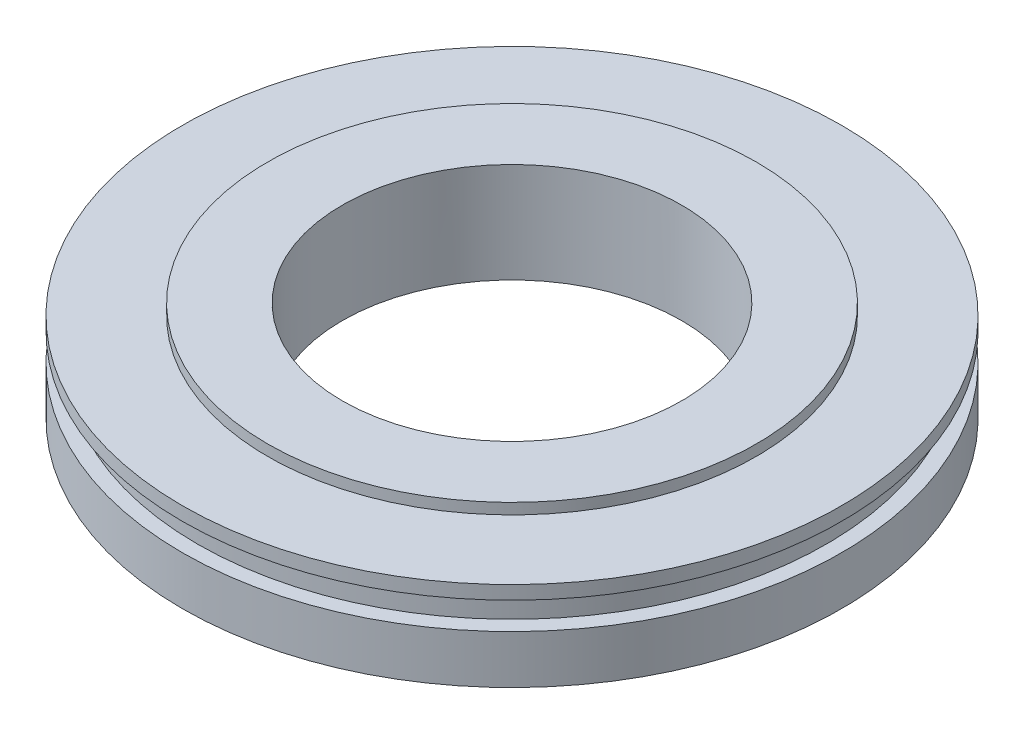
from build123d import *

# Parameters (mm, degrees)
BANDAID_START                  = 0.053848
SKETCH3_R                      = 30.84068
SKETCH3_R_2                    = 15.875
BANDAID_SOLUTION_THICKER_DEPTH = 0.053848
SKETCH4_R                      = 22.86
SKETCH4_R_2                    = 15.875
LIP_FOR_BEARING_DEPTH          = 1.016
SKETCH5_R                      = 30.84068
SKETCH5_R_2                    = 15.875
BOSS_EXTRUDE1_DEPTH            = 0.57912


with BuildPart() as part:
    # Sketch1 → Revolve1 (revolve)
    with BuildSketch(Plane(origin=(0, 0, 0), x_dir=(0, 0, -1), z_dir=(1, 0, 0))):
        Polygon((-15.875, 2.694084), (-15.875, -5.020818), (-30.84068, -5.020818), (-30.84068, -1.062068), (-29.43479, -1.062068), (-29.43479, 1.477932), (-30.84068, 1.477932), (-30.84068, 2.694084), align=None)
    revolve(axis=Axis((0, 0, 0), (0, -1, 0)))

    # Sketch3 → BandAid Solution thicker (add)
    with BuildSketch(Plane(origin=(0, 2.694084, 0), x_dir=(1, 0, 0), z_dir=(0, 1, 0)).offset(BANDAID_START)):
        with Locations(Location((0, 0, 0), (0, 0, 270))):
            Circle(SKETCH3_R)
        with Locations(Location((0, 0, 0), (0, 0, 270))):
            Circle(SKETCH3_R_2, mode=Mode.SUBTRACT)
    extrude(amount=-BANDAID_SOLUTION_THICKER_DEPTH)

    # Sketch4 → Lip for Bearing (add)
    with BuildSketch(Plane(origin=(0, 2.747932, 0), x_dir=(1, 0, 0), z_dir=(0, 1, 0))):
        with Locations(Location((0, 0, 0), (0, 0, 90))):
            Circle(SKETCH4_R)
        with Locations(Location((0, 0, 0), (0, 0, 270))):
            Circle(SKETCH4_R_2, mode=Mode.SUBTRACT)
    extrude(amount=LIP_FOR_BEARING_DEPTH)

    # Sketch5 → Boss-Extrude1 (add)
    with BuildSketch(Plane.XZ.offset(5.020818)):
        with Locations(Location((0, 0, 0), (0, 0, 90))):
            Circle(SKETCH5_R)
        with Locations(Location((0, 0, 0), (0, 0, 90))):
            Circle(SKETCH5_R_2, mode=Mode.SUBTRACT)
    extrude(amount=BOSS_EXTRUDE1_DEPTH)


solid = part.part
